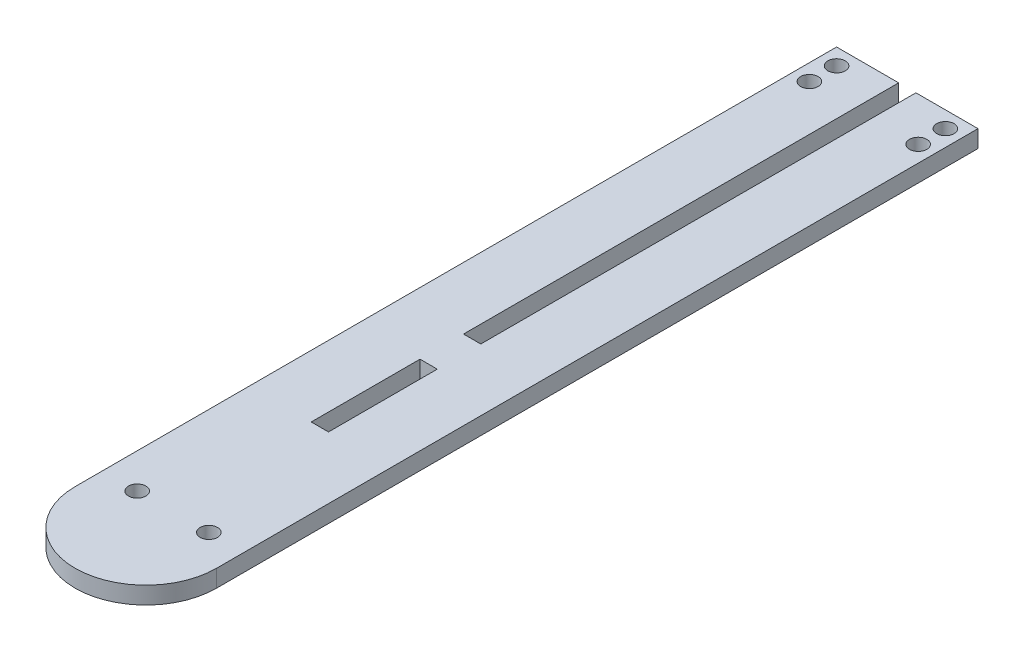
from build123d import *

# Parameters (mm, degrees)
SKETCH1_W               = 3.175
SKETCH1_H               = 20
BOSS_EXTRUDE1_DEPTH     = 3.175
CUT_EXTRUDE1_DEPTH      = 154.72662678
CUT_EXTRUDE1_DEPTH_BACK = 154.72662678
SKETCH2_R               = 1.6
CUT_EXTRUDE2_DEPTH      = 154.72662678
CUT_EXTRUDE2_DEPTH_BACK = 154.72662678
SKETCH3_R               = 1.6


with BuildPart() as part:
    # Sketch1 → Boss-Extrude1 (new body)
    with BuildSketch(Plane(origin=(0, 0, 0), x_dir=(1, 0, 0), z_dir=(0, 1, 0))):
        with BuildLine():
            Line((-14.5875, 0), (-14.5875, -140))
            ThreePointArc((-14.5875, -140), (-1.5875, -153), (11.4125, -140))
            Line((11.4125, -140), (11.4125, 0))
            Line((11.4125, 0), (0, 0))
            Line((0, 0), (0, -80))
            Line((0, -80), (-3.175, -80))
            Line((-3.175, -80), (-3.175, 0))
            Line((-3.175, 0), (-14.5875, 0))
        make_face()
        with Locations((-1.5875, -98)):
            Rectangle(SKETCH1_W, SKETCH1_H, mode=Mode.SUBTRACT)
    extrude(amount=BOSS_EXTRUDE1_DEPTH)

    # Sketch2 → Cut-Extrude1 (cut, two sides: drawn at the far end of the back side and taken through both)
    with BuildSketch(Plane(origin=(0, 3.175, 0), x_dir=(1, 0, 0), z_dir=(0, 1, 0)).offset(-CUT_EXTRUDE1_DEPTH_BACK)):
        with Locations(Location((5, -135, 0), (0, 0, 270))):
            Circle(SKETCH2_R)
        with Locations(Location((-8.175, -135, 0), (0, 0, 270))):
            Circle(SKETCH2_R)
    extrude(amount=CUT_EXTRUDE1_DEPTH + CUT_EXTRUDE1_DEPTH_BACK, mode=Mode.SUBTRACT)

    # Sketch3 → Cut-Extrude2 (cut, two sides: drawn at the far end of the back side and taken through both)
    with BuildSketch(Plane(origin=(0, 3.175, 0), x_dir=(1, 0, 0), z_dir=(0, 1, 0)).offset(-CUT_EXTRUDE2_DEPTH_BACK)):
        with Locations(Location((-11.5875, -8, 0), (0, 0, 270))):
            Circle(SKETCH3_R)
        with Locations(Location((-11.5875, -3, 0), (0, 0, 270))):
            Circle(SKETCH3_R)
        with Locations(Location((8.4125, -8, 0), (0, 0, 270))):
            Circle(SKETCH3_R)
        with Locations(Location((8.4125, -3, 0), (0, 0, 270))):
            Circle(SKETCH3_R)
    extrude(amount=CUT_EXTRUDE2_DEPTH + CUT_EXTRUDE2_DEPTH_BACK, mode=Mode.SUBTRACT)


solid = part.part
